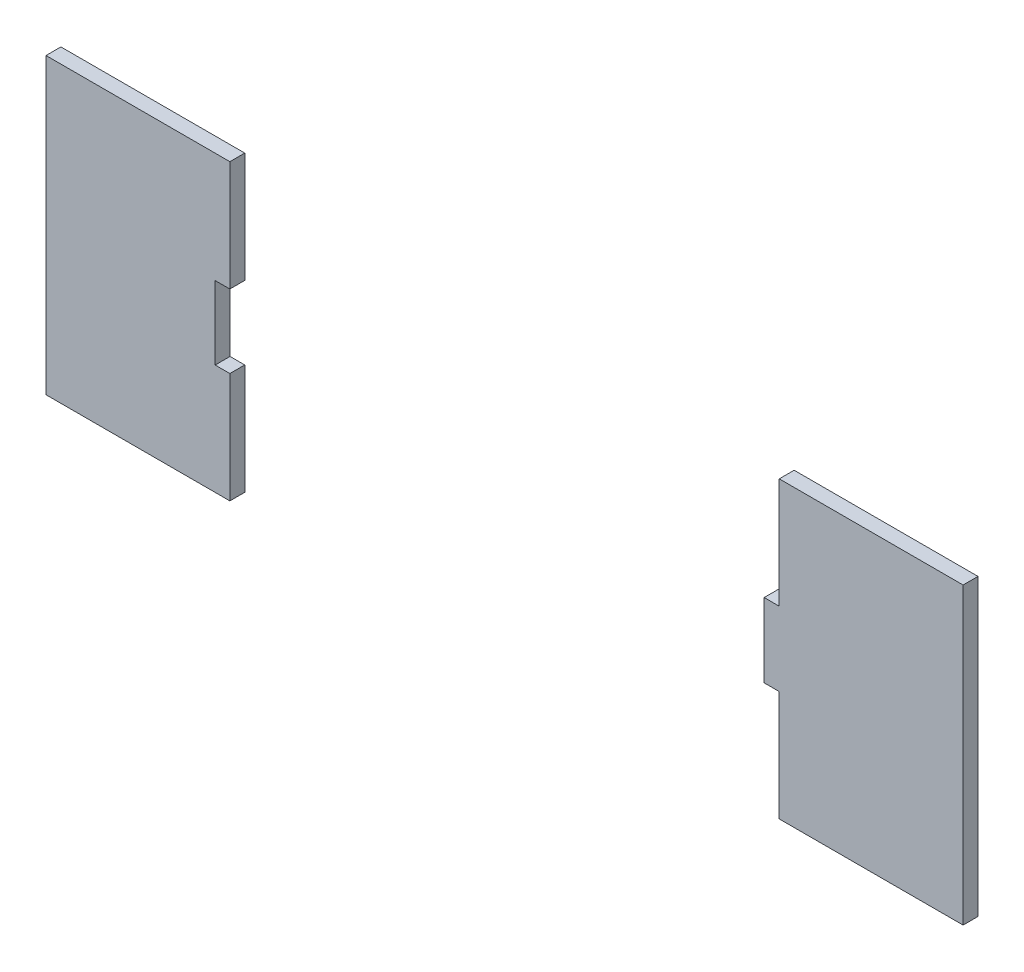
from build123d import *

# Parameters (mm, degrees)
ESTRUSIONE_ESTRUSIONE1_DEPTH = 4.05
ESTRUSIONE_ESTRUSIONE2_DEPTH = 4.05


with BuildPart() as part:
    # Schizzo1 → Estrusione-Estrusione1 (new body)
    with BuildSketch(Plane.XY):
        Polygon((-1.673277118, -33.721656051), (-1.673277118, -63.721656051), (-51.673277118, -63.721656051), (-51.673277118, 16.178343949), (-1.673277118, 16.178343949), (-1.673277118, -13.821656051), (-5.673277118, -13.821656051), (-5.673277118, -33.721656051), align=None)
    extrude(amount=ESTRUSIONE_ESTRUSIONE1_DEPTH)


with BuildPart() as body_2:
    # Schizzo1<3> → Estrusione-Estrusione2 (new body)
    with BuildSketch(Plane.XY):
        Polygon((147.724938623, -33.921656051), (147.724938623, -63.921656051), (197.724938623, -63.921656051), (197.724938623, 16.178343949), (147.724938623, 16.178343949), (147.724938623, -13.821656051), (143.624938623, -13.821656051), (143.624938623, -33.921656051), align=None)
    extrude(amount=ESTRUSIONE_ESTRUSIONE2_DEPTH)


solid = Compound([part.part, body_2.part])
